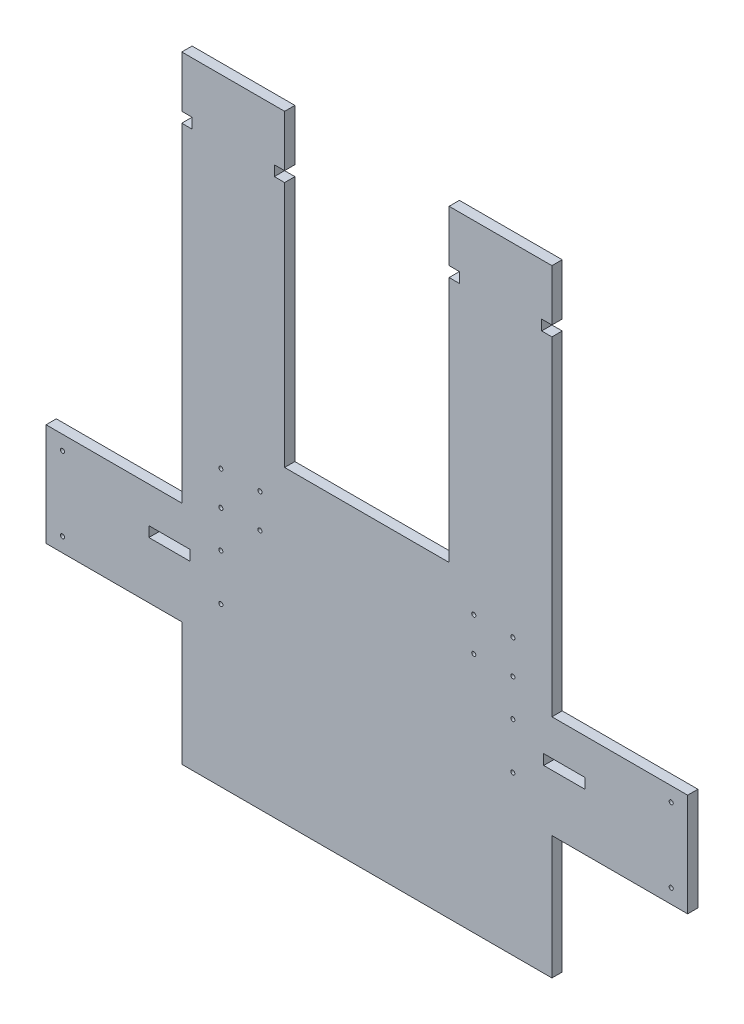
from build123d import *

# Parameters (mm, degrees)
SKETCH1_W           = 66
SKETCH1_H           = 50
SKETCH1_R           = 1
BOSS_EXTRUDE1_DEPTH = 5
SKETCH2_R           = 1
CUT_EXTRUDE1_DEPTH  = 388.996134001
SKETCH3_R           = 1
SKETCH3_W           = 20
SKETCH3_H           = 5
CUT_EXTRUDE2_DEPTH  = 388.996134001
SKETCH4_W           = 5
SKETCH4_H           = 5
CUT_EXTRUDE3_DEPTH  = 388.996134001


with BuildPart() as part:
    # Sketch1 → Boss-Extrude1 (new body)
    # profile 1 of 3: a face of its own
    with BuildSketch(Plane.XY):
        with Locations((-33, 85)):
            Rectangle(SKETCH1_W, SKETCH1_H)
    # profile 2 of 3: a face of its own
    with BuildSketch(Plane.XY):
        Polygon((0, 60), (0, 0), (180, 0), (180, 60), (180, 110), (180, 300), (130, 300), (130, 150), (50, 150), (50, 300), (0, 300), (0, 110), align=None)
        with Locations((19, 117.5)):
            Circle(SKETCH1_R, mode=Mode.SUBTRACT)
        with Locations((38, 117.5)):
            Circle(SKETCH1_R, mode=Mode.SUBTRACT)
        with Locations((19, 134)):
            Circle(SKETCH1_R, mode=Mode.SUBTRACT)
        with Locations((38, 134)):
            Circle(SKETCH1_R, mode=Mode.SUBTRACT)
        with Locations((142, 117.5)):
            Circle(SKETCH1_R, mode=Mode.SUBTRACT)
        with Locations((161, 117.5)):
            Circle(SKETCH1_R, mode=Mode.SUBTRACT)
        with Locations((142, 134)):
            Circle(SKETCH1_R, mode=Mode.SUBTRACT)
        with Locations((161, 134)):
            Circle(SKETCH1_R, mode=Mode.SUBTRACT)
    # profile 3 of 3: a face of its own
    with BuildSketch(Plane.XY):
        with Locations((213, 85)):
            Rectangle(SKETCH1_W, SKETCH1_H)
    extrude(amount=BOSS_EXTRUDE1_DEPTH)

    # Sketch2 → Cut-Extrude1 (cut, through all)
    with BuildSketch(Plane.XY.offset(5)):
        with Locations((-58, 103)):
            Circle(SKETCH2_R)
        with Locations((-58, 67)):
            Circle(SKETCH2_R)
        with Locations(Location((238, 67, 0), (0, 0, 180))):
            Circle(SKETCH2_R)
        with Locations(Location((238, 103, 0), (0, 0, 180))):
            Circle(SKETCH2_R)
    extrude(amount=-CUT_EXTRUDE1_DEPTH, mode=Mode.SUBTRACT)

    # Sketch3 → Cut-Extrude2 (cut, through all)
    with BuildSketch(Plane.XY.offset(5)):
        with Locations((19, 77)):
            Circle(SKETCH3_R)
        with Locations((19, 99.5)):
            Circle(SKETCH3_R)
        with Locations(Location((161, 77, 0), (0, 0, 180))):
            Circle(SKETCH3_R)
        with Locations(Location((161, 99.5, 0), (0, 0, 180))):
            Circle(SKETCH3_R)
        with Locations((-6, 90)):
            Rectangle(SKETCH3_W, SKETCH3_H)
        with Locations((186, 90)):
            Rectangle(SKETCH3_W, SKETCH3_H)
    extrude(amount=-CUT_EXTRUDE2_DEPTH, mode=Mode.SUBTRACT)

    # Sketch4 → Cut-Extrude3 (cut, through all)
    with BuildSketch(Plane.XY.offset(5)):
        with Locations((2.5, 272.5)):
            Rectangle(SKETCH4_W, SKETCH4_H)
        with Locations((47.5, 272.5)):
            Rectangle(SKETCH4_W, SKETCH4_H)
        with Locations((132.5, 272.5)):
            Rectangle(SKETCH4_W, SKETCH4_H)
        with Locations((177.5, 272.5)):
            Rectangle(SKETCH4_W, SKETCH4_H)
    extrude(amount=-CUT_EXTRUDE3_DEPTH, mode=Mode.SUBTRACT)


solid = part.part
